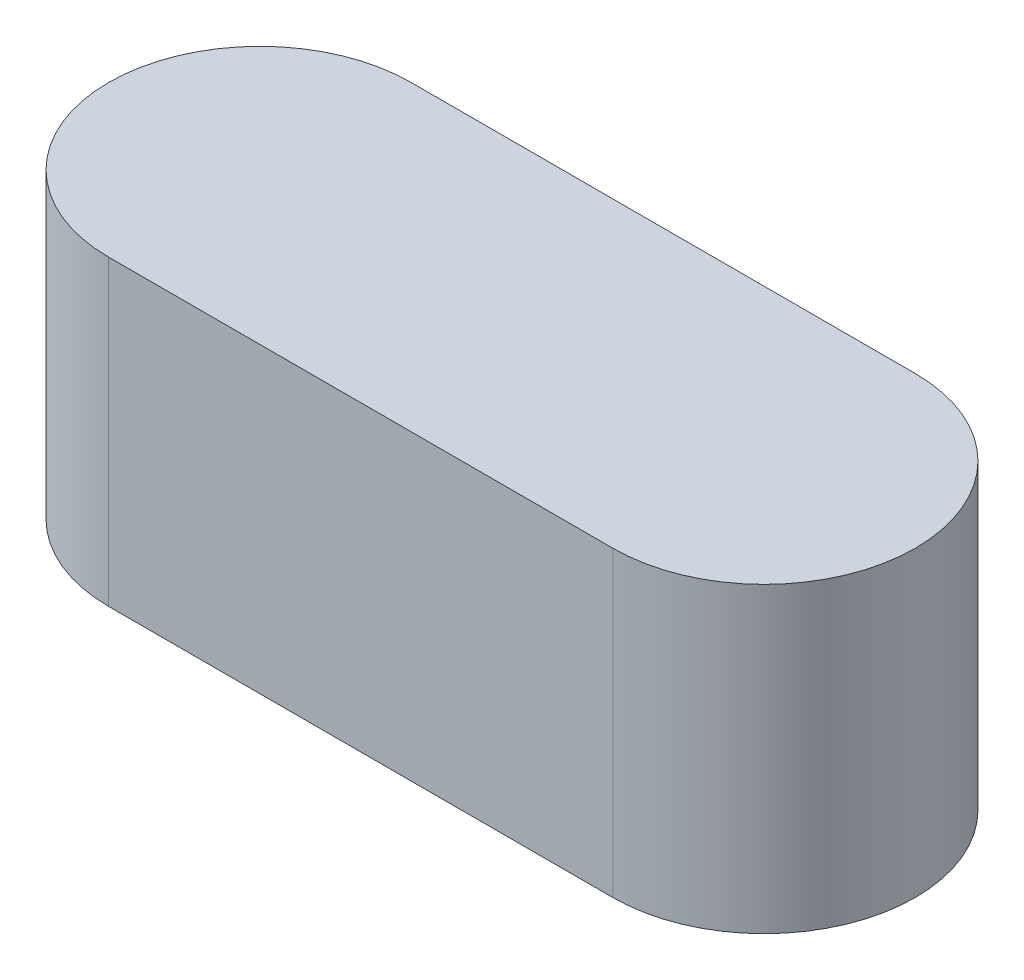
from build123d import *

# Parameters (mm, degrees)
EXTRUDE_1_DEPTH = 6


with BuildPart() as part:
    # 草图1 → 凸台-拉伸1 (new body)
    with BuildSketch(Plane(origin=(0, 0, 0), x_dir=(1, 0, 0), z_dir=(0, 1, 0))):
        with BuildLine():
            Line((0, 3), (10, 3))
            ThreePointArc((10, 3), (13, 0), (10, -3))
            Line((10, -3), (0, -3))
            ThreePointArc((0, -3), (-3, 0), (0, 3))
        make_face()
    extrude(amount=EXTRUDE_1_DEPTH)


solid = part.part
